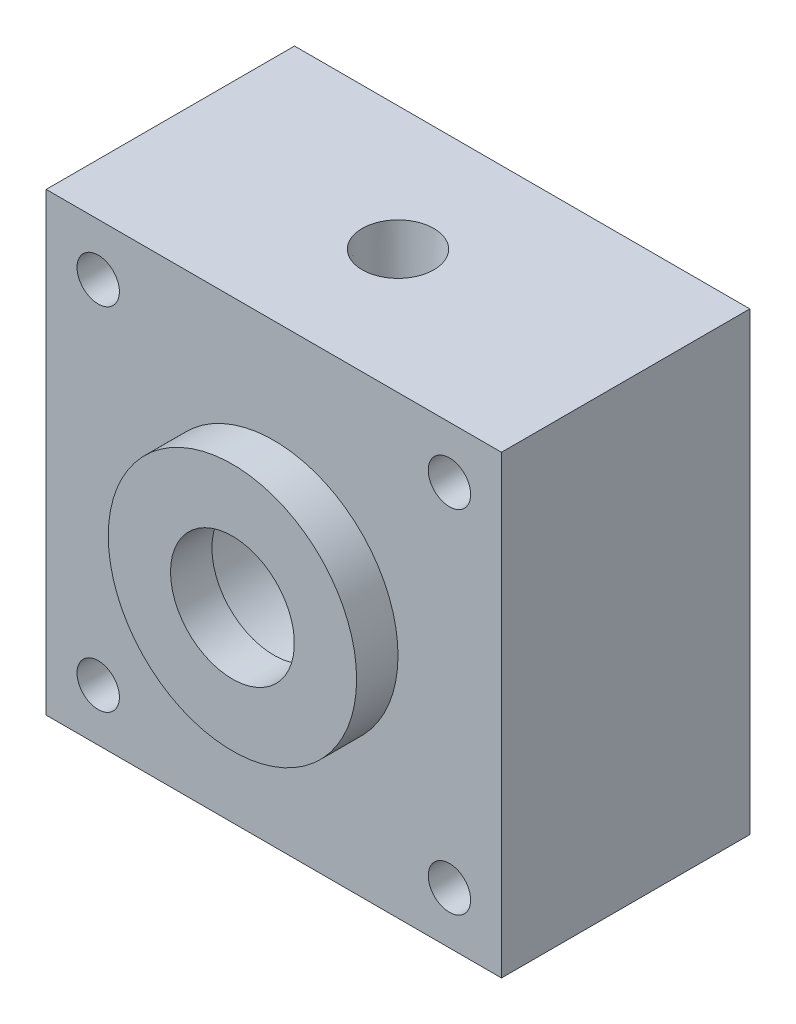
from build123d import *

# Parameters (mm, degrees)
SKETCH1_W           = 34.925
SKETCH1_H           = 34.925
BASE_EXTRUDE_DEPTH  = 19.05
SKETCH12_R          = 15.875
SKETCH12_R_2        = 14.25
CUT_EXTRUDE4_DEPTH  = 1.524
SKETCH3_R           = 1.625
CUT_EXTRUDE2_DEPTH  = 32.189426293
CIRPATTERN2_COUNT   = 4
SKETCH15_R          = 9.525
BOSS_EXTRUDE1_DEPTH = 3.175
SKETCH14_R          = 4.75
CUT_EXTRUDE6_DEPTH  = 34.223913639
CUT_EXTRUDE7_START  = -19.05
SKETCH16_R          = 6.35
CUT_EXTRUDE7_DEPTH  = 19.05


with BuildPart() as part:
    # Sketch1 → Base-Extrude (new body)
    with BuildSketch(Plane.XY):
        Rectangle(SKETCH1_W, SKETCH1_H)
    extrude(amount=BASE_EXTRUDE_DEPTH)

    # Sketch12 → Cut-Extrude4 (cut)
    with BuildSketch(Plane(origin=(-5.978518985, 12.821273311, 0), x_dir=(-1, 0, 0), z_dir=(0, 0, -1))):
        with Locations((-5.978518985, -12.821273311)):
            Circle(SKETCH12_R)
        with Locations((-5.978518985, -12.821273311)):
            Circle(SKETCH12_R_2, mode=Mode.SUBTRACT)
    extrude(amount=-CUT_EXTRUDE4_DEPTH, mode=Mode.SUBTRACT)

    # Sketch3 → Cut-Extrude2 (cut, through all)
    with BuildSketch(Plane.XY.offset(19.05)):
        with Locations((13.470384182, 13.470384182)):
            Circle(SKETCH3_R)
    cut_extrude2 = extrude(amount=-CUT_EXTRUDE2_DEPTH, mode=Mode.SUBTRACT)

    # CirPattern2: Cut-Extrude2 ×4 about axis
    cirpattern2_axis = Axis((0, 0, 0), (0, 0, 1))
    for i in range(1, CIRPATTERN2_COUNT):
        add(cut_extrude2.rotate(cirpattern2_axis, i * 360 / CIRPATTERN2_COUNT), mode=Mode.SUBTRACT)

    # Sketch10 → Hole3 (revolve, cut)
    with BuildSketch(Plane(origin=(0, 17.4625, 9.525), x_dir=(0, 0, 1), z_dir=(1, 0, 0))):
        Polygon((0, 0), (0, 7.799876674), (2.413, 6.35), (2.413, 4.826), (2.750466794, 0), align=None)
    revolve(axis=Axis((0, 21.469039452, 9.525), (0, -1, 0)), mode=Mode.SUBTRACT)

    # Sketch15 → Boss-Extrude1 (add)
    with BuildSketch(Plane.XY.offset(19.05)):
        with Locations(Location((0, 0, 0), (0, 0, 180))):
            Circle(SKETCH15_R)
    extrude(amount=BOSS_EXTRUDE1_DEPTH)

    # Sketch14 → Cut-Extrude6 (cut, through all)
    with BuildSketch(Plane(origin=(0, 0, 0), x_dir=(-1, 0, 0), z_dir=(0, 0, -1))):
        Circle(SKETCH14_R)
    extrude(amount=-CUT_EXTRUDE6_DEPTH, mode=Mode.SUBTRACT)

    # Sketch16 → Cut-Extrude7 (cut)
    with BuildSketch(Plane(origin=(0, 0, 0), x_dir=(-1, 0, 0), z_dir=(0, 0, -1)).offset(CUT_EXTRUDE7_START)):
        Circle(SKETCH16_R)
    extrude(amount=CUT_EXTRUDE7_DEPTH, mode=Mode.SUBTRACT)

    # Sketch17 → Cut-Revolve1 (revolve, cut)
    with BuildSketch(Plane(origin=(0, 0, 0), x_dir=(0, 0, -1), z_dir=(1, 0, 0))):
        Polygon((-9.525, 11.1125), (-10.514867037, 10.541), (-4.09906217, -0.5715), (-3.109195134, 0), align=None)
    revolve(axis=Axis((0, 11.1125, 9.525), (0, -0.8660254037844396, -0.4999999999999983)), mode=Mode.SUBTRACT)


solid = part.part
